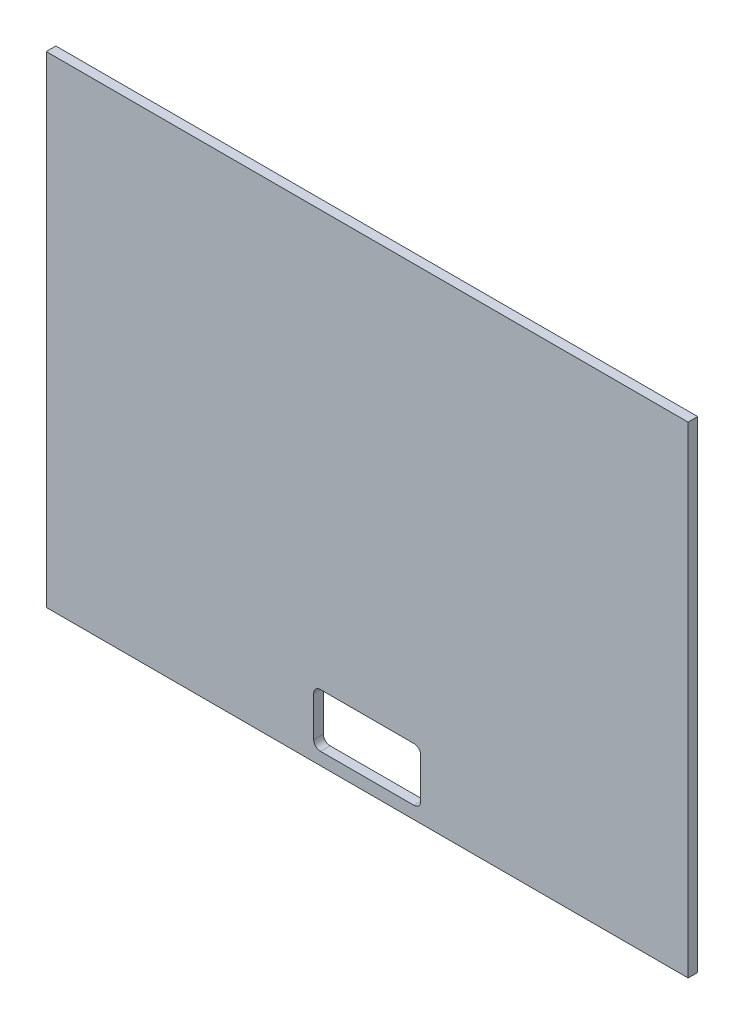
from build123d import *

# Parameters (mm, degrees)
SKETCH1_W           = 1219.2
SKETCH1_H           = 914.4
BOSS_EXTRUDE1_DEPTH = 18.25625
SKETCH2_W           = 203.2
SKETCH2_H           = 101.6
CUT_EXTRUDE1_DEPTH  = 933.742714077
FILLET1_R           = 12.7


with BuildPart() as part:
    # Sketch1 → Boss-Extrude1 (new body)
    with BuildSketch(Plane.XY):
        with Locations((203.2, 0)):
            Rectangle(SKETCH1_W, SKETCH1_H)
    extrude(amount=BOSS_EXTRUDE1_DEPTH)

    # Sketch2 → Cut-Extrude1 (cut, through all)
    with BuildSketch(Plane.XY.offset(18.25625)):
        with Locations((203.2, -382.699600817)):
            Rectangle(SKETCH2_W, SKETCH2_H)
    extrude(amount=-CUT_EXTRUDE1_DEPTH, mode=Mode.SUBTRACT)

    # Fillet1
    fillet1_edges = [part.edges().sort_by_distance(p)[0] for p in [
        (101.6, -433.499600817, 9.128125),
        (101.6, -331.899600817, 9.128125),
        (304.8, -331.899600817, 9.128125),
        (304.8, -433.499600817, 9.128125),
    ]]
    fillet(fillet1_edges, radius=FILLET1_R)


solid = part.part
